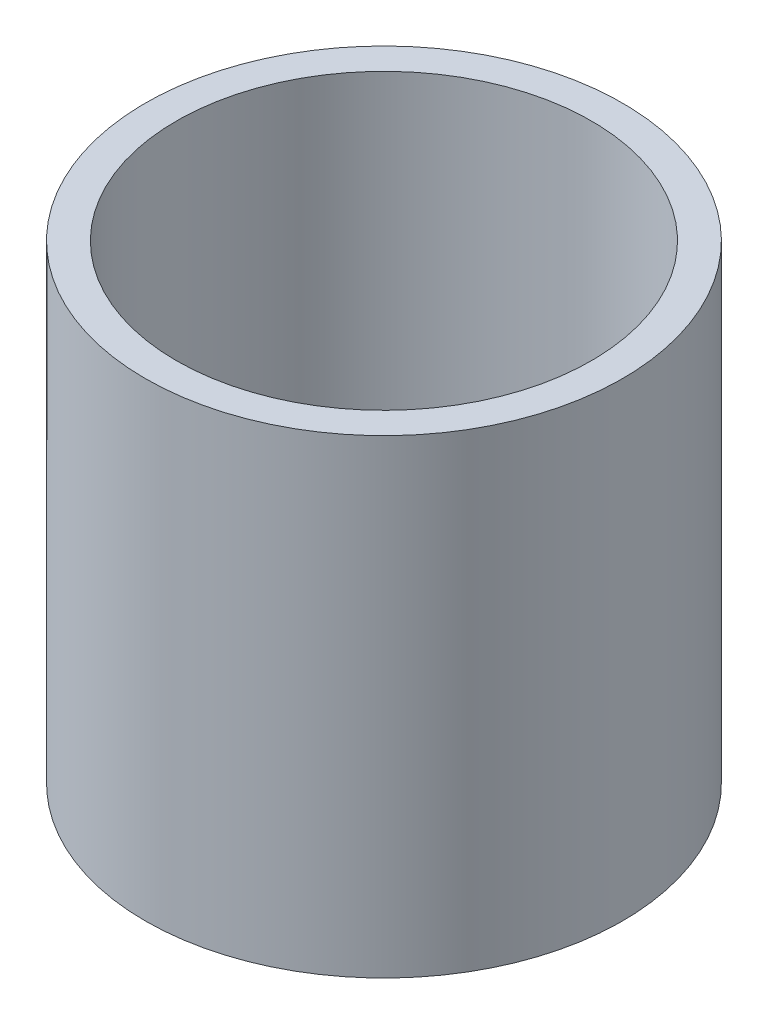
from build123d import *

# Parameters (mm, degrees)
SKETCH1_R           = 12.7
SKETCH1_R_2         = 11.049
BOSS_EXTRUDE1_DEPTH = 25


with BuildPart() as part:
    # Sketch1 → Boss-Extrude1 (new body)
    with BuildSketch(Plane(origin=(0, 0, 0), x_dir=(1, 0, 0), z_dir=(0, 1, 0))):
        with Locations(Location((0, 0, 0), (0, 0, 270))):
            Circle(SKETCH1_R)
        with Locations(Location((0, 0, 0), (0, 0, 270))):
            Circle(SKETCH1_R_2, mode=Mode.SUBTRACT)
    extrude(amount=BOSS_EXTRUDE1_DEPTH)


solid = part.part
